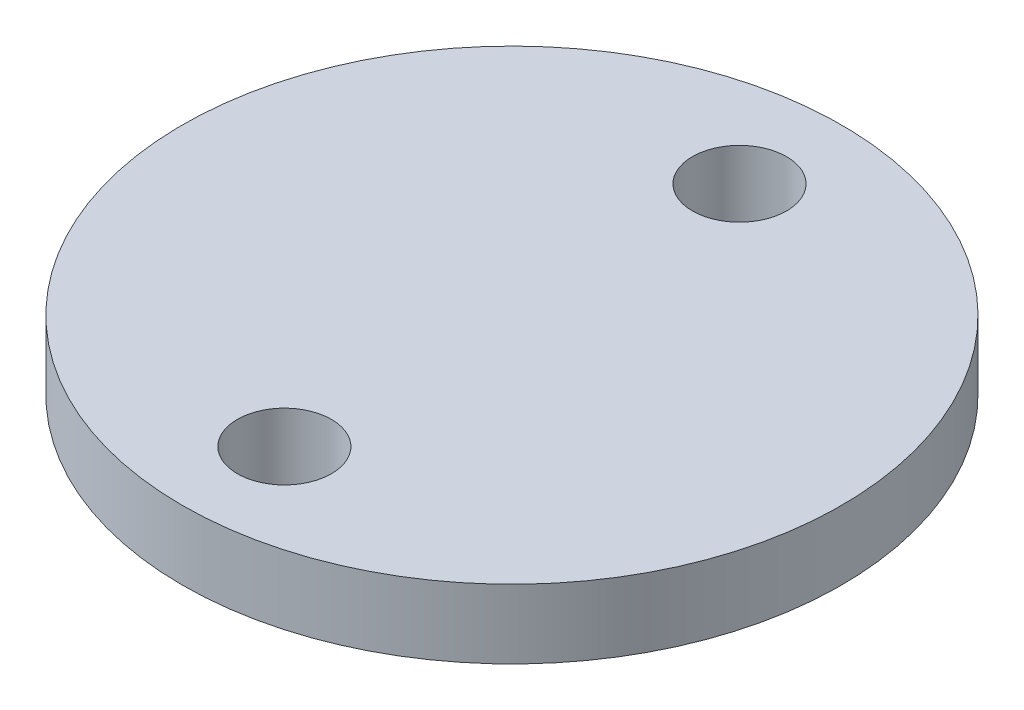
from build123d import *

# Parameters (mm, degrees)
SKETCH1_R           = 10.5
BOSS_EXTRUDE1_DEPTH = 2.2
SKETCH2_R           = 1.5
CUT_EXTRUDE1_DEPTH  = 2.2
SKETCH3_R           = 4.5
BOSS_EXTRUDE2_DEPTH = 4
CUT_EXTRUDE5_DEPTH  = 4
SKETCH5_R           = 2.5
CUT_EXTRUDE6_DEPTH  = 4
FILLET1_R           = 0.1


with BuildPart() as part:
    # Sketch1 → Boss-Extrude1 (new body)
    with BuildSketch(Plane(origin=(0, 0, 0), x_dir=(1, 0, 0), z_dir=(0, 1, 0))):
        with Locations(Location((0, 0, 0), (0, 0, 270))):
            Circle(SKETCH1_R)
    extrude(amount=BOSS_EXTRUDE1_DEPTH)

    # Sketch2 → Cut-Extrude1 (cut)
    with BuildSketch(Plane(origin=(0, 2.2, 0), x_dir=(1, 0, 0), z_dir=(0, 1, 0))):
        with Locations(Location((0, 7.25, 0), (0, 0, 270))):
            Circle(SKETCH2_R)
        with Locations(Location((0, -7.25, 0), (0, 0, 90))):
            Circle(SKETCH2_R)
    extrude(amount=-CUT_EXTRUDE1_DEPTH, mode=Mode.SUBTRACT)

    # Sketch3 → Boss-Extrude2 (add)
    with BuildSketch(Plane.XZ):
        with Locations(Location((0, 0, 0), (0, 0, 90))):
            Circle(SKETCH3_R)
    extrude(amount=BOSS_EXTRUDE2_DEPTH)

    # Sketch4 → Cut-Extrude5 (cut)
    with BuildSketch(Plane.XZ.offset(4)):
        with BuildLine():
            Line((0.400521458, 1.962035311), (0.546385434, 2.949824225))
            ThreePointArc((0.546385434, 2.949824225), (0.375999701, 2.976344104), (0.204371722, 2.993030604))
            Line((0.204371722, 2.993030604), (0.1, 2))
            ThreePointArc((0.1, 2), (0, 1.9), (-0.1, 2))
            Line((-0.1, 2), (-0.204371722, 2.993030604))
            ThreePointArc((-0.204371722, 2.993030604), (-0.375999701, 2.976344104), (-0.546385434, 2.949824225))
            Line((-0.546385434, 2.949824225), (-0.400521458, 1.962035311))
            ThreePointArc((-0.400521458, 1.962035311), (-0.472510786, 1.840308006), (-0.59423809, 1.912297334))
            Line((-0.59423809, 1.912297334), (-0.942287452, 2.848173864))
            ThreePointArc((-0.942287452, 2.848173864), (-1.104373658, 2.789329458), (-1.262811185, 2.72126954))
            Line((-1.262811185, 2.72126954), (-0.87587668, 1.800788727))
            ThreePointArc((-0.87587668, 1.800788727), (-0.915331981, 1.664982692), (-1.051138016, 1.704437993))
            Line((-1.051138016, 1.704437993), (-1.620995796, 2.524355884))
            ThreePointArc((-1.620995796, 2.524355884), (-1.763355757, 2.427050983), (-1.899889864, 2.321727483))
            Line((-1.899889864, 2.321727483), (-1.296197349, 1.526391965))
            ThreePointArc((-1.296197349, 1.526391965), (-1.300639501, 1.385040392), (-1.441991075, 1.389482544))
            Line((-1.441991075, 1.389482544), (-2.197851012, 2.041923341))
            ThreePointArc((-2.197851012, 2.041923341), (-2.311539728, 1.912271969), (-2.417591476, 1.776302748))
            Line((-2.417591476, 1.776302748), (-1.635073172, 1.156086383))
            ThreePointArc((-1.635073172, 1.156086383), (-1.604223058, 1.01807091), (-1.742238531, 0.987220797))
            Line((-1.742238531, 0.987220797), (-2.636607166, 1.431189244))
            ThreePointArc((-2.636607166, 1.431189244), (-2.714481157, 1.277337875), (-2.783386924, 1.11926638))
            Line((-2.783386924, 1.11926638), (-1.871211333, 0.71313964))
            ThreePointArc((-1.871211333, 0.71313964), (-1.807007381, 0.587132289), (-1.933014732, 0.522928337))
            Line((-1.933014732, 0.522928337), (-2.909695595, 0.730528263))
            ThreePointArc((-2.909695595, 0.730528263), (-2.946861752, 0.562143944), (-2.974291936, 0.391902388))
            Line((-2.974291936, 0.391902388), (-1.989774405, 0.225383712))
            ThreePointArc((-1.989774405, 0.225383712), (-1.896250784, 0.119301987), (-2.002332509, 0.025778366))
            Line((-2.002332509, 0.025778366), (-2.999957149, -0.016034495))
            ThreePointArc((-2.999957149, -0.016034495), (-2.994080185, -0.188371559), (-2.978311246, -0.360086272))
            Line((-2.978311246, -0.360086272), (-1.983312633, -0.276533904))
            ThreePointArc((-1.983312633, -0.276533904), (-1.866345776, -0.356024498), (-1.94583637, -0.472991354))
            Line((-1.94583637, -0.472991354), (-2.901720362, -0.761589746))
            ThreePointArc((-2.901720362, -0.761589746), (-2.853169549, -0.927050983), (-2.795192307, -1.089449387))
            Line((-2.795192307, -1.089449387), (-1.852232034, -0.761075878))
            ThreePointArc((-1.852232034, -0.761075878), (-1.7191714, -0.808980654), (-1.767076176, -0.942041288))
            Line((-1.767076176, -0.942041288), (-2.621157813, -1.459291513))
            ThreePointArc((-2.621157813, -1.459291513), (-2.532983777, -1.607480385), (-2.436441155, -1.750358391))
            Line((-2.436441155, -1.750358391), (-1.604768885, -1.197796655))
            ThreePointArc((-1.604768885, -1.197796655), (-1.463975161, -1.211105581), (-1.477284087, -1.351899304))
            Line((-1.477284087, -1.351899304), (-2.175898278, -2.065300628))
            ThreePointArc((-2.175898278, -2.065300628), (-2.053641318, -2.186905882), (-1.924599445, -2.301285939))
            Line((-1.924599445, -2.301285939), (-1.256472204, -1.559255464))
            ThreePointArc((-1.256472204, -1.559255464), (-1.116791979, -1.537132289), (-1.094668805, -1.676812514))
            Line((-1.094668805, -1.676812514), (-1.593919052, -2.541539308))
            ThreePointArc((-1.593919052, -2.541539308), (-1.445261022, -2.62892004), (-1.291828074, -2.707615229))
            Line((-1.291828074, -2.707615229), (-0.829226754, -1.822740517))
            ThreePointArc((-0.829226754, -1.822740517), (-0.69943665, -1.766575323), (-0.643271457, -1.896365427))
            Line((-0.643271457, -1.896365427), (-0.911788031, -2.858083726))
            ThreePointArc((-0.911788031, -2.858083726), (-0.746069661, -2.905749483), (-0.577886394, -2.943815095))
            Line((-0.577886394, -2.943815095), (-0.349877937, -1.971696079))
            ThreePointArc((-0.349877937, -1.971696079), (-0.238133144, -1.885017932), (-0.151454997, -1.996762726))
            Line((-0.151454997, -1.996762726), (-0.172366014, -2.995044233))
            ThreePointArc((-0.172366014, -2.995044233), (0, -3), (0.172366014, -2.995044233))
            Line((0.172366014, -2.995044233), (0.151454997, -1.996762726))
            ThreePointArc((0.151454997, -1.996762726), (0.238133144, -1.885017932), (0.349877937, -1.971696079))
            Line((0.349877937, -1.971696079), (0.577886394, -2.943815095))
            ThreePointArc((0.577886394, -2.943815095), (0.746069661, -2.905749483), (0.911788031, -2.858083726))
            Line((0.911788031, -2.858083726), (0.643271457, -1.896365427))
            ThreePointArc((0.643271457, -1.896365427), (0.69943665, -1.766575323), (0.829226754, -1.822740517))
            Line((0.829226754, -1.822740517), (1.291828074, -2.707615229))
            ThreePointArc((1.291828074, -2.707615229), (1.445261022, -2.62892004), (1.593919052, -2.541539308))
            Line((1.593919052, -2.541539308), (1.094668805, -1.676812514))
            ThreePointArc((1.094668805, -1.676812514), (1.116791979, -1.537132289), (1.256472204, -1.559255464))
            Line((1.256472204, -1.559255464), (1.924599445, -2.301285939))
            ThreePointArc((1.924599445, -2.301285939), (2.053641318, -2.186905882), (2.175898278, -2.065300628))
            Line((2.175898278, -2.065300628), (1.477284087, -1.351899304))
            ThreePointArc((1.477284087, -1.351899304), (1.463975161, -1.211105581), (1.604768885, -1.197796655))
            Line((1.604768885, -1.197796655), (2.436441155, -1.750358391))
            ThreePointArc((2.436441155, -1.750358391), (2.532983777, -1.607480385), (2.621157813, -1.459291513))
            Line((2.621157813, -1.459291513), (1.767076176, -0.942041288))
            ThreePointArc((1.767076176, -0.942041288), (1.7191714, -0.808980654), (1.852232034, -0.761075878))
            Line((1.852232034, -0.761075878), (2.795192307, -1.089449387))
            ThreePointArc((2.795192307, -1.089449387), (2.853169549, -0.927050983), (2.901720362, -0.761589746))
            Line((2.901720362, -0.761589746), (1.94583637, -0.472991354))
            ThreePointArc((1.94583637, -0.472991354), (1.866345776, -0.356024498), (1.983312633, -0.276533904))
            Line((1.983312633, -0.276533904), (2.978311246, -0.360086272))
            ThreePointArc((2.978311246, -0.360086272), (2.994080185, -0.188371559), (2.999957149, -0.016034495))
            Line((2.999957149, -0.016034495), (2.002332509, 0.025778366))
            ThreePointArc((2.002332509, 0.025778366), (1.896250784, 0.119301987), (1.989774405, 0.225383712))
            Line((1.989774405, 0.225383712), (2.974291936, 0.391902388))
            ThreePointArc((2.974291936, 0.391902388), (2.946861752, 0.562143944), (2.909695595, 0.730528263))
            Line((2.909695595, 0.730528263), (1.933014732, 0.522928337))
            ThreePointArc((1.933014732, 0.522928337), (1.807007381, 0.587132289), (1.871211333, 0.71313964))
            Line((1.871211333, 0.71313964), (2.783386924, 1.11926638))
            ThreePointArc((2.783386924, 1.11926638), (2.714481157, 1.277337875), (2.636607166, 1.431189244))
            Line((2.636607166, 1.431189244), (1.742238531, 0.987220797))
            ThreePointArc((1.742238531, 0.987220797), (1.604223058, 1.01807091), (1.635073172, 1.156086383))
            Line((1.635073172, 1.156086383), (2.417591476, 1.776302748))
            ThreePointArc((2.417591476, 1.776302748), (2.311539728, 1.912271969), (2.197851012, 2.041923341))
            Line((2.197851012, 2.041923341), (1.441991075, 1.389482544))
            ThreePointArc((1.441991075, 1.389482544), (1.300639501, 1.385040392), (1.296197349, 1.526391965))
            Line((1.296197349, 1.526391965), (1.899889864, 2.321727483))
            ThreePointArc((1.899889864, 2.321727483), (1.763355757, 2.427050983), (1.620995796, 2.524355884))
            Line((1.620995796, 2.524355884), (1.051138016, 1.704437993))
            ThreePointArc((1.051138016, 1.704437993), (0.915331981, 1.664982692), (0.87587668, 1.800788727))
            Line((0.87587668, 1.800788727), (1.262811185, 2.72126954))
            ThreePointArc((1.262811185, 2.72126954), (1.104373658, 2.789329458), (0.942287452, 2.848173864))
            Line((0.942287452, 2.848173864), (0.59423809, 1.912297334))
            ThreePointArc((0.59423809, 1.912297334), (0.472510786, 1.840308006), (0.400521458, 1.962035311))
        make_face()
    extrude(amount=-CUT_EXTRUDE5_DEPTH, mode=Mode.SUBTRACT)

    # Sketch5 → Cut-Extrude6 (cut)
    with BuildSketch(Plane.XZ.offset(4)):
        Circle(SKETCH5_R)
    extrude(amount=-CUT_EXTRUDE6_DEPTH, mode=Mode.SUBTRACT)

    # Fillet1
    fillet1_edges = [part.edges().sort_by_distance(p)[0] for p in [
        (-0.473285352, -2, 2.454791432),
        (-0.152065582, -2, 2.495370926),
        (0.152065582, -2, 2.495370926),
        (0.473285352, -2, 2.454791432),
        (0.767861676, -2, 2.379157087),
        (1.068898026, -2, 2.259968365),
        (1.335410198, -2, 2.113452059),
        (1.597347907, -2, 1.923143173),
        (1.819049985, -2, 1.714951065),
        (2.025430544, -2, 1.465479823),
        (2.188392171, -2, 1.208693388),
        (2.326247931, -2, 0.915734986),
        (2.420229629, -2, 0.62648906),
        (2.480898605, -2, 0.308451153),
        (2.499995158, -2, 0.004920121),
        (2.479665295, -2, -0.318213802),
        (2.422676798, -2, -0.616957967),
        (2.322625496, -2, -0.924884212),
        (2.193132744, -2, -1.200070318),
        (2.019646594, -2, -1.473440747),
        (1.825786094, -2, -1.707777837),
        (1.58976587, -2, -1.92941558),
        (1.343718589, -2, -2.108179393),
        (1.059994309, -2, -2.264158136),
        (0.777220303, -2, -2.376116285),
        (0.463619407, -2, -2.45663531),
        (0.161886407, -2, -2.494753052),
        (-0.161886407, -2, -2.494753052),
        (-0.463619407, -2, -2.45663531),
        (-0.777220303, -2, -2.376116285),
        (-1.059994309, -2, -2.264158136),
        (-1.343718589, -2, -2.108179393),
        (-1.58976587, -2, -1.92941558),
        (-1.825786094, -2, -1.707777837),
        (-2.019646594, -2, -1.473440747),
        (-2.193132744, -2, -1.200070318),
        (-2.322625496, -2, -0.924884212),
        (-2.422676798, -2, -0.616957967),
        (-2.479665295, -2, -0.318213802),
        (-2.499995158, -2, 0.004920121),
        (-2.480898605, -2, 0.308451153),
        (-2.420229629, -2, 0.62648906),
        (-2.326247931, -2, 0.915734986),
        (-2.188392171, -2, 1.208693388),
        (-2.025430544, -2, 1.465479823),
        (-1.819049985, -2, 1.714951065),
        (-1.597347907, -2, 1.923143173),
        (-1.335410198, -2, 2.113452059),
        (-1.068898026, -2, 2.259968365),
        (-0.767861676, -2, 2.379157087),
    ]]
    fillet(fillet1_edges, radius=FILLET1_R)


solid = part.part
